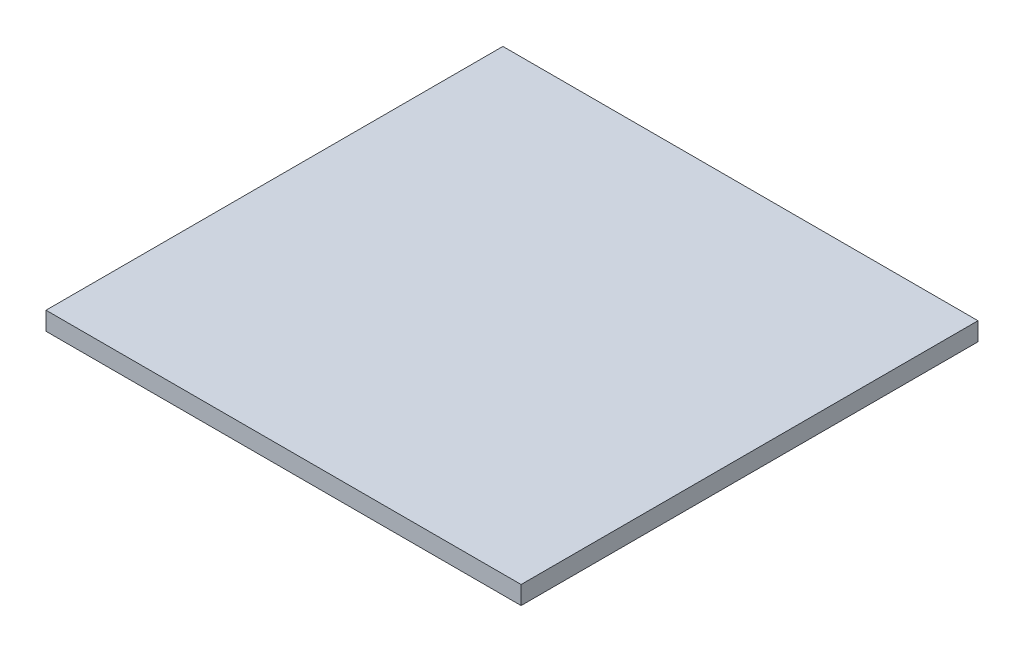
from build123d import *

# Parameters (mm, degrees)
SKETCH1_W           = 660.4
SKETCH1_H           = 635.092087706
BOSS_EXTRUDE1_DEPTH = 25.4


with BuildPart() as part:
    # Sketch1 → Boss-Extrude1 (new body)
    with BuildSketch(Plane(origin=(0, 0, 0), x_dir=(1, 0, 0), z_dir=(0, 1, 0))):
        with Locations((-330.2, 317.546043853)):
            Rectangle(SKETCH1_W, SKETCH1_H)
    extrude(amount=BOSS_EXTRUDE1_DEPTH)


solid = part.part
